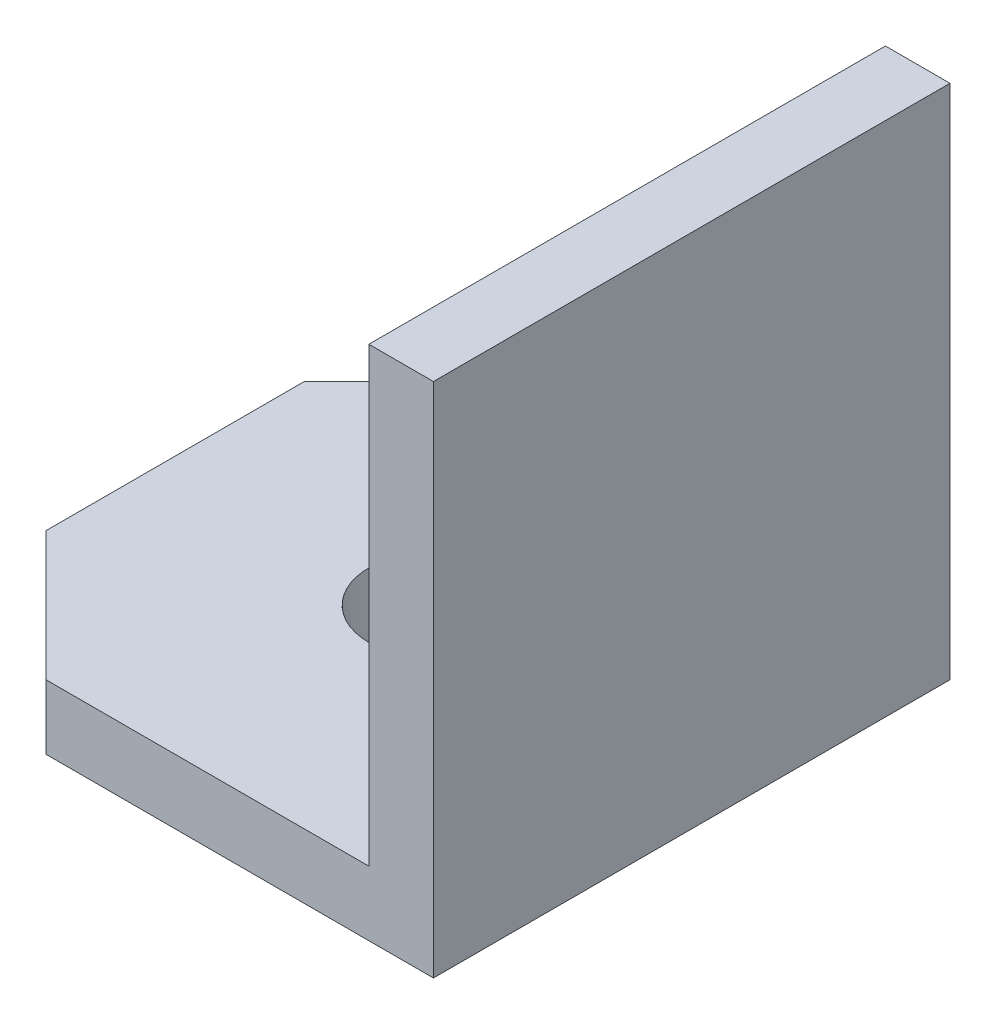
from build123d import *

# Parameters (mm, degrees)
EXTRUDE_THIN1_DEPTH = 40
CHAMFER1_SIZE       = 10
SKETCH2_R           = 5
CUT_EXTRUDE1_DEPTH  = 10


with BuildPart() as part:
    # Sketch1 → Extrude-Thin1 (new body)
    with BuildSketch(Plane.XY):
        Polygon((-40, 0), (0, 0), (0, 40), (-5, 40), (-5, 5), (-40, 5), align=None)
    extrude(amount=EXTRUDE_THIN1_DEPTH)

    # Chamfer1
    chamfer1_edges = [part.edges().sort_by_distance(p)[0] for p in [
        (-40, 2.5, 40),
        (-40, 2.5, 0),
    ]]
    chamfer(chamfer1_edges, length=CHAMFER1_SIZE)

    # Sketch2 → Cut-Extrude1 (cut)
    with BuildSketch(Plane(origin=(0, 5, 0), x_dir=(1, 0, 0), z_dir=(0, 1, 0))):
        with Locations(Location((-20, -20, 0), (0, 0, 270))):
            Circle(SKETCH2_R)
    extrude(amount=-CUT_EXTRUDE1_DEPTH, mode=Mode.SUBTRACT)


solid = part.part
